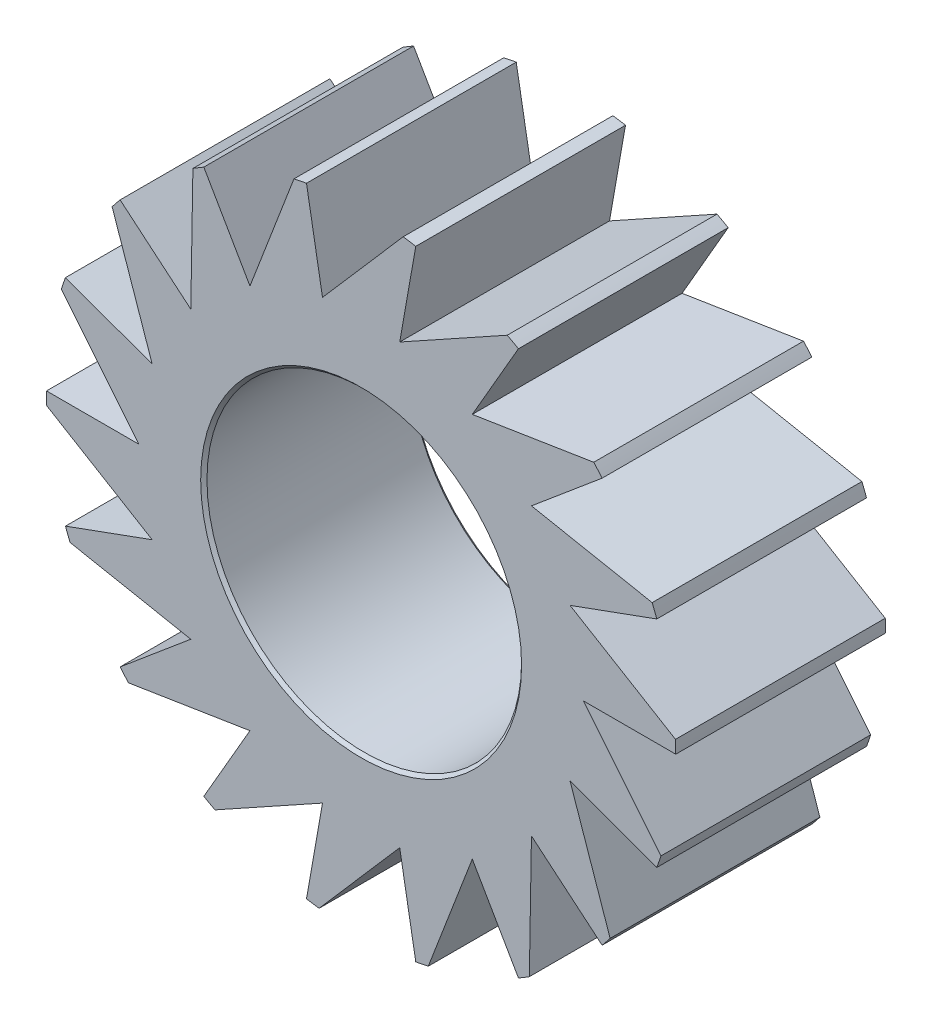
from build123d import *

# Parameters (mm, degrees)
SKETCH1_R               = 6.731
SKETCH1_R_2             = 4.7625
BOSS_EXTRUDE1_DEPTH     = 6.35
BOSS_EXTRUDE2_DEPTH     = 6.35
CIRPATTERN1_COUNT       = 18
CHAMFER1_SIZE           = 0.09525
SKETCH3_R               = 314.325
SKETCH3_R_2             = 9.525
CUT_EXTRUDE_THIN1_DEPTH = 16.60964661


with BuildPart() as part:
    # Sketch1 → Boss-Extrude1 (new body)
    with BuildSketch(Plane.XY):
        Circle(SKETCH1_R)
        Circle(SKETCH1_R_2, mode=Mode.SUBTRACT)
    extrude(amount=-BOSS_EXTRUDE1_DEPTH)

    # Sketch2 → Boss-Extrude2 (add)
    with BuildSketch(Plane.XY):
        with BuildLine():
            Line((-1.168825884, 6.628740986), (1.764265485, 10.005646771))
            Line((1.764265485, 10.005646771), (1.168825884, 6.628740986))
            ThreePointArc((1.168825884, 6.628740986), (0, 6.731), (-1.168825884, 6.628740986))
        make_face()
    boss_extrude2 = extrude(amount=-BOSS_EXTRUDE2_DEPTH)

    # CirPattern1: Boss-Extrude2 ×18 about axis
    cirpattern1_axis = Axis((0, 0, 0), (0, 0, 1))
    for i in range(1, CIRPATTERN1_COUNT):
        add(boss_extrude2.rotate(cirpattern1_axis, i * 360 / CIRPATTERN1_COUNT))

    # Chamfer1
    chamfer1_edges = [part.edges().sort_by_distance(p)[0] for p in [
        (-4.7625, 0, -6.35),
        (-4.7625, 0, 0),
    ]]
    chamfer(chamfer1_edges, length=CHAMFER1_SIZE)

    # Sketch3 → Cut-Extrude-Thin1 (cut, through all)
    with BuildSketch(Plane.XY):
        Circle(SKETCH3_R)
        Circle(SKETCH3_R_2, mode=Mode.SUBTRACT)
    extrude(amount=-CUT_EXTRUDE_THIN1_DEPTH, mode=Mode.SUBTRACT)


solid = part.part
